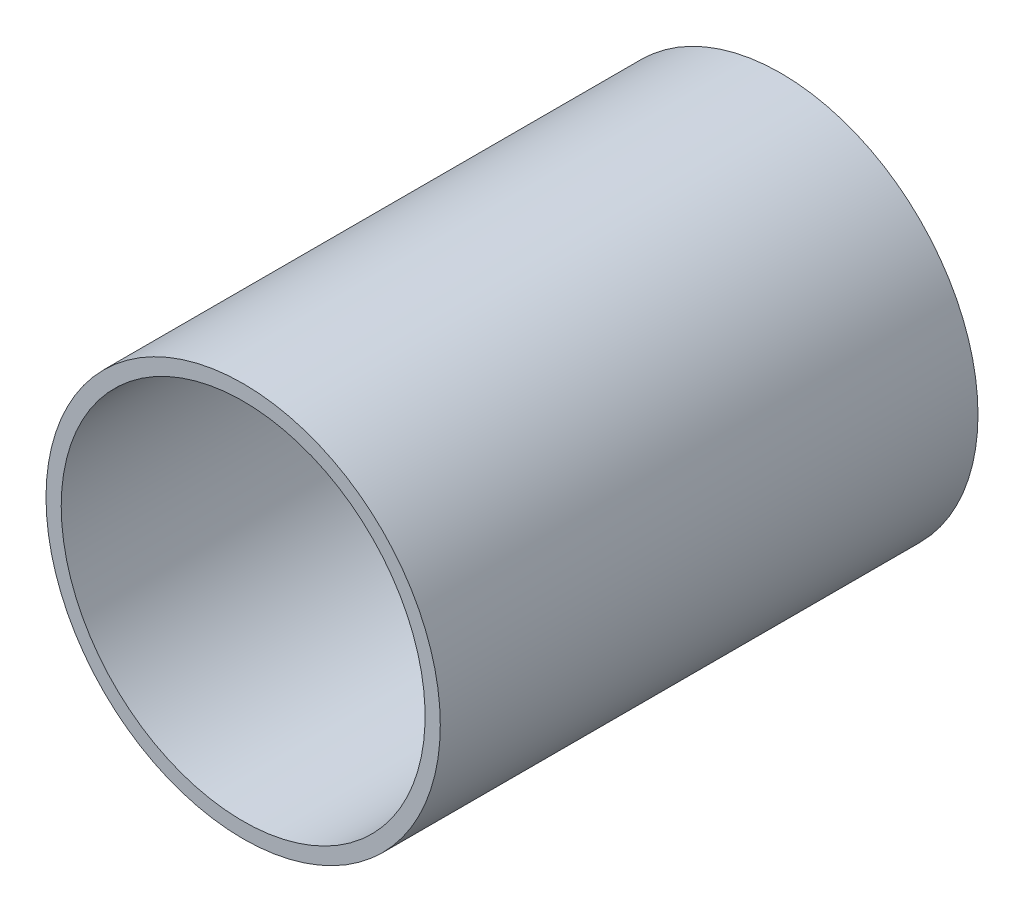
from build123d import *

# Parameters (mm, degrees)
SKETCH1_R           = 33
BOSS_EXTRUDE2_DEPTH = 90
SKETCH2_R           = 30.4546
CUT_EXTRUDE1_DEPTH  = 90


with BuildPart() as part:
    # Sketch1 → Boss-Extrude2 (new body)
    with BuildSketch(Plane.XY):
        with Locations(Location((0, 0, 0), (0, 0, 180))):
            Circle(SKETCH1_R)
    extrude(amount=BOSS_EXTRUDE2_DEPTH)

    # Sketch2 → Cut-Extrude1 (cut)
    with BuildSketch(Plane(origin=(0, 0, 0), x_dir=(-1, 0, 0), z_dir=(0, 0, -1))):
        Circle(SKETCH2_R)
    extrude(amount=-CUT_EXTRUDE1_DEPTH, mode=Mode.SUBTRACT)


solid = part.part
